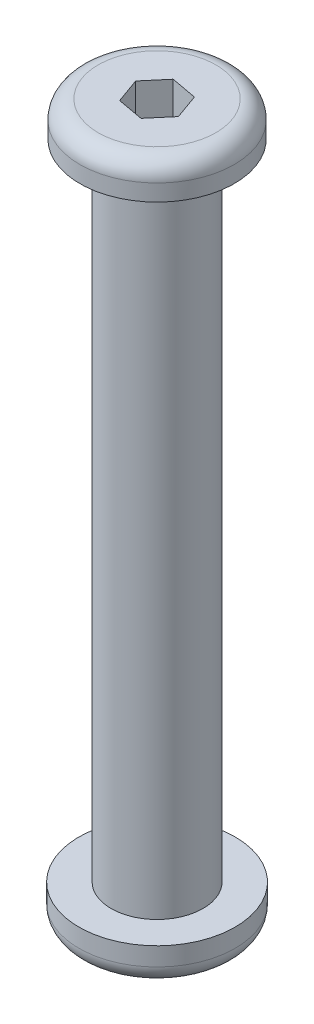
from build123d import *

# Parameters (mm, degrees)
SKETCH_1_R      = 2.5
EXTRUDE_1_DEPTH = 35
SKETCH_2_R      = 4.2
EXTRUDE_2_DEPTH = 1.9
SKETCH_3_R      = 4.25
EXTRUDE_3_DEPTH = 2
FILLET_1_R      = 1


with BuildPart() as part:
    # 草图1 → 凸台-拉伸1 (new body)
    with BuildSketch(Plane(origin=(0, 0, 0), x_dir=(1, 0, 0), z_dir=(0, 1, 0))):
        with Locations(Location((0, 0, 0), (0, 0, 270))):
            Circle(SKETCH_1_R)
    extrude(amount=EXTRUDE_1_DEPTH)

    # 草图2 → 凸台-拉伸2 (add)
    with BuildSketch(Plane(origin=(0, 35, 0), x_dir=(1, 0, 0), z_dir=(0, 1, 0))):
        with Locations(Location((0, 0, 0), (0, 0, 90))):
            Circle(SKETCH_2_R)
        Polygon((0.933529185, 1.100843583), (-0.486593916, 1.358881781), (-1.420123101, 0.258038198), (-0.933529185, -1.100843583), (0.486593916, -1.358881781), (1.420123101, -0.258038198), align=None, mode=Mode.SUBTRACT)
    extrude(amount=EXTRUDE_2_DEPTH)

    # 草图3 → 凸台-拉伸3 (add)
    with BuildSketch(Plane.XZ):
        with Locations(Location((0, 0, 0), (0, 0, 270))):
            Circle(SKETCH_3_R)
        Polygon((0.831789315, 1.179601572), (-0.605670271, 1.310151463), (-1.437459585, 0.130549891), (-0.831789315, -1.179601572), (0.605670271, -1.310151463), (1.437459585, -0.130549891), align=None, mode=Mode.SUBTRACT)
    extrude(amount=EXTRUDE_3_DEPTH)

    # 圆角1
    fillet_1_edges = [part.edges().sort_by_distance(p)[0] for p in [
        (0, 36.9, 4.2),
        (0, -2, 4.25),
    ]]
    fillet(fillet_1_edges, radius=FILLET_1_R)


solid = part.part
